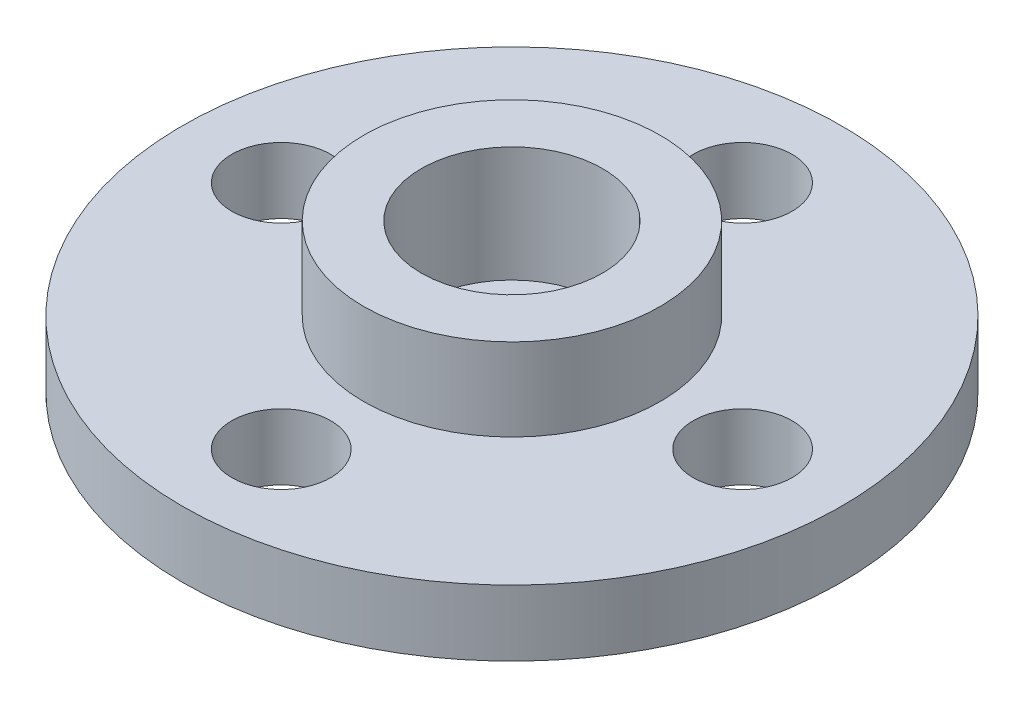
from build123d import *

# Parameters (mm, degrees)
SKETCH1_R           = 10
BOSS_EXTRUDE1_DEPTH = 2
SKETCH2_R           = 4.5
BOSS_EXTRUDE2_DEPTH = 2.5
SKETCH3_R           = 2.75
CUT_EXTRUDE1_DEPTH  = 3.5
SKETCH4_R           = 1.5
CUT_EXTRUDE2_DEPTH  = 15.568802284
SKETCH5_R           = 1.5
CUT_EXTRUDE3_DEPTH  = 15.361406616


with BuildPart() as part:
    # Sketch1 → Boss-Extrude1 (new body)
    with BuildSketch(Plane(origin=(0, 0, 0), x_dir=(1, 0, 0), z_dir=(0, 1, 0))):
        with Locations(Location((0, 0, 0), (0, 0, 270))):
            Circle(SKETCH1_R)
    extrude(amount=BOSS_EXTRUDE1_DEPTH)

    # Sketch2 → Boss-Extrude2 (add)
    with BuildSketch(Plane(origin=(0, 2, 0), x_dir=(1, 0, 0), z_dir=(0, 1, 0))):
        with Locations(Location((0, 0, 0), (0, 0, 270))):
            Circle(SKETCH2_R)
    extrude(amount=BOSS_EXTRUDE2_DEPTH)

    # Sketch3 → Cut-Extrude1 (cut)
    with BuildSketch(Plane(origin=(0, 4.5, 0), x_dir=(1, 0, 0), z_dir=(0, 1, 0))):
        with Locations(Location((0, 0, 0), (0, 0, 270))):
            Circle(SKETCH3_R)
    extrude(amount=-CUT_EXTRUDE1_DEPTH, mode=Mode.SUBTRACT)

    # Sketch4 → Cut-Extrude2 (cut, through all)
    with BuildSketch(Plane(origin=(0, 1, 0), x_dir=(1, 0, 0), z_dir=(0, 1, 0))):
        with Locations(Location((0, 0, 0), (0, 0, 270))):
            Circle(SKETCH4_R)
    extrude(amount=-CUT_EXTRUDE2_DEPTH, mode=Mode.SUBTRACT)

    # Sketch5 → Cut-Extrude3 (cut, through all)
    with BuildSketch(Plane(origin=(0, 2, 0), x_dir=(1, 0, 0), z_dir=(0, 1, 0))):
        with Locations(Location((0, 7, 0), (0, 0, 270))):
            Circle(SKETCH5_R)
        with Locations(Location((7, 0, 0), (0, 0, 270))):
            Circle(SKETCH5_R)
        with Locations(Location((0, -7, 0), (0, 0, 270))):
            Circle(SKETCH5_R)
        with Locations(Location((-7, 0, 0), (0, 0, 270))):
            Circle(SKETCH5_R)
    extrude(amount=-CUT_EXTRUDE3_DEPTH, mode=Mode.SUBTRACT)


solid = part.part
